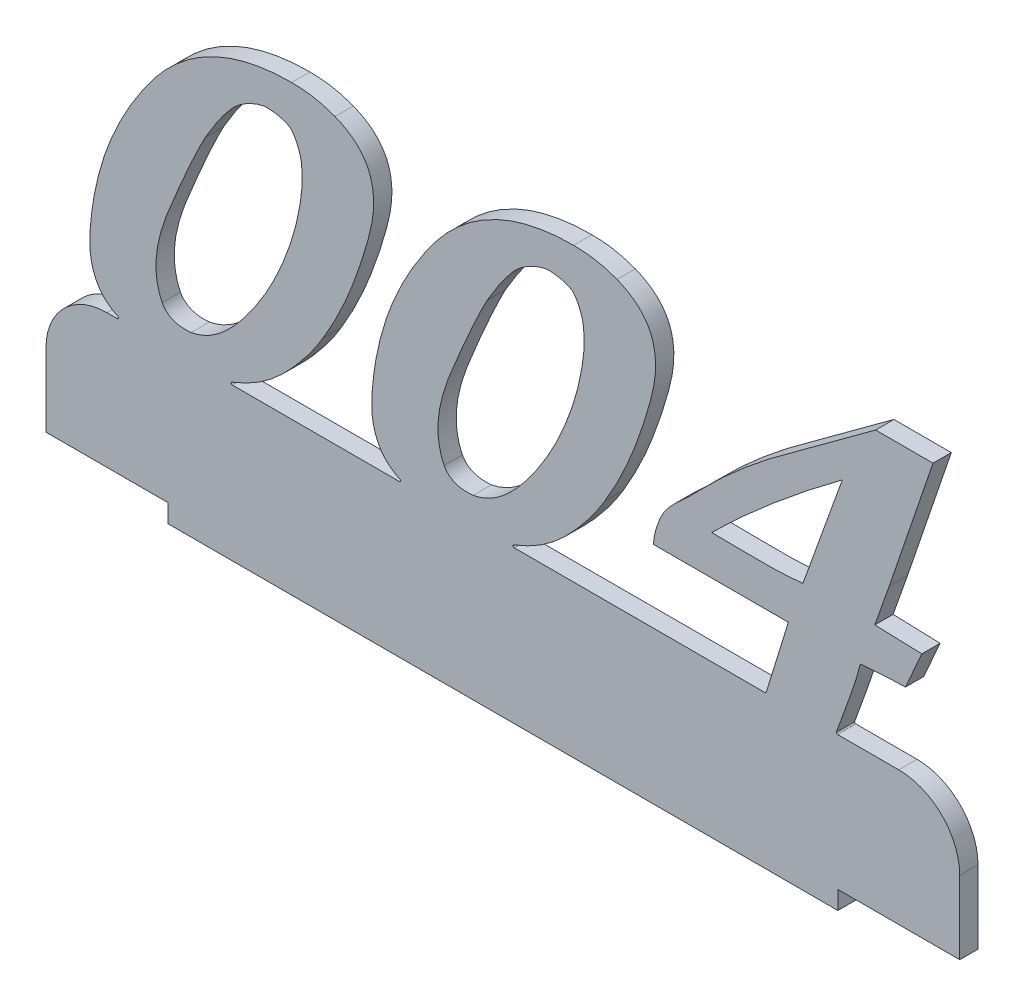
from build123d import *

# Parameters (mm, degrees)
BOSS_EXTRUDE1_DEPTH = 3
FILLET1_R           = 10
FILLET2_R           = 0.2


with BuildPart() as part:
    # Sketch1 → Boss-Extrude1 (new body)
    with BuildSketch(Plane.XY):
        with BuildLine():
            Line((129.670523122, 22.00000042), (150, 22.000001608))
            Line((150, 22.000001608), (150, 0))
            Line((150, 0), (130, 0))
            Line((130, 0), (130, -3))
            Line((130, -3), (20, -3))
            Line((20, -3), (20, 0))
            Line((20, 0), (0, 0))
            Line((0, 0), (0, 22.000000009))
            Line((0, 22.000000009), (12.808046382, 22.000000009))
            add(Edge.make_bspline(
                [(12.808046382, 22.000000009), (12.364004517, 22.144270634), (11.446828202, 22.485704618), (10.207076422, 23.292214922), (9.097113426, 24.311275464), (8.267240019, 25.588546311), (7.661757766, 27.060076512), (7.108133359, 29.424918694), (7.17776559, 31.344625269), (7.268107856, 32.659158535)],
                knots=[0.510217075, 0.510217075, 0.510217075, 0.510217075, 0.562299825, 0.61931963, 0.674487907, 0.729675441, 0.788153341, 0.851799168, 1, 1, 1, 1], degree=3))
            add(Edge.make_bspline(
                [(7.268107856, 32.659158535), (7.435031923, 34.887254942), (7.924224793, 38.212828568), (9.053611265, 42.549632686), (10.11644366, 45.758996068), (11.471067103, 48.892333585), (13.009065327, 51.99816281), (14.816801856, 55.041311751), (16.823886932, 58.008445774), (19.021425369, 60.79779447), (21.495680175, 63.216608271), (24.137944609, 65.304239959), (27.018164863, 66.951630752), (30.053664859, 68.299472442), (34.476072536, 69.521801178), (37.954791392, 69.906515458), (40.321274393, 69.875733984)],
                knots=[0, 0, 0, 0, 0.122246067, 0.183381441, 0.245050885, 0.307031795, 0.37001055, 0.434578783, 0.500534692, 0.565957523, 0.628479512, 0.689453544, 0.749684058, 0.80955899, 0.870724503, 1, 1, 1, 1], degree=3))
            add(Edge.make_bspline(
                [(40.321274393, 69.875733984), (41.581513848, 69.86528413), (44.02435313, 69.721768199), (46.364507053, 69.011912404), (47.455754455, 68.605210137)],
                knots=[0, 0, 0, 0, 0.519885394, 1, 1, 1, 1], degree=3))
            add(Edge.make_bspline(
                [(47.455754455, 68.605210137), (48.723301869, 68.089911925), (50.518354527, 67.096561954), (52.257667193, 65.113649934), (53.167189286, 63.440175814), (53.682471868, 61.535257), (53.847782842, 59.418211638), (53.654675405, 57.087443094), (52.905275139, 53.748035551), (51.626754793, 49.581607466), (49.325571182, 43.278027952), (47.128655, 38.851750561), (45.462009342, 36.099346181)],
                knots=[0, 0, 0, 0, 0.111905612, 0.162582178, 0.212592743, 0.265416324, 0.321765959, 0.384451445, 0.45478123, 0.599580751, 0.738515281, 1, 1, 1, 1], degree=3))
            add(Edge.make_bspline(
                [(45.462009342, 36.099346181), (44.370525223, 34.242133898), (42.50022779, 31.671659412), (39.750876411, 28.548676302), (37.582181514, 26.479408468), (35.199749836, 24.671746013), (32.52002604, 23.1759519), (30.552809414, 22.376261659), (29.502251655, 22.015031961), (29.458207776, 22.000000009)],
                knots=[0, 0, 0, 0, 0.257859597, 0.380113614, 0.498337489, 0.61657684, 0.737567111, 0.865047578, 0.870621389, 0.870621389, 0.870621389, 0.870621389], degree=3))
            Line((29.458207776, 22.000000009), (59.094207445, 22.000000009))
            add(Edge.make_bspline(
                [(59.094207445, 22.000000009), (58.65016558, 22.144270634), (57.732989265, 22.485704618), (56.493237485, 23.292214922), (55.383274489, 24.311275464), (54.553401082, 25.588546311), (53.947918829, 27.060076512), (53.394294422, 29.424918694), (53.463926653, 31.344625269), (53.55426892, 32.659158535)],
                knots=[0.510217075, 0.510217075, 0.510217075, 0.510217075, 0.562299825, 0.61931963, 0.674487907, 0.729675441, 0.788153341, 0.851799168, 1, 1, 1, 1], degree=3))
            add(Edge.make_bspline(
                [(53.55426892, 32.659158535), (53.721192986, 34.887254942), (54.210385856, 38.212828568), (55.339772329, 42.549632686), (56.402604724, 45.758996068), (57.757228167, 48.892333585), (59.295226391, 51.99816281), (61.10296292, 55.041311751), (63.110047996, 58.008445774), (65.307586432, 60.79779447), (67.781841238, 63.216608271), (70.424105672, 65.304239959), (73.304325926, 66.951630752), (76.339825922, 68.299472442), (80.762233599, 69.521801178), (84.240952455, 69.906515458), (86.607435456, 69.875733984)],
                knots=[0, 0, 0, 0, 0.122246067, 0.183381441, 0.245050885, 0.307031795, 0.37001055, 0.434578783, 0.500534692, 0.565957523, 0.628479512, 0.689453544, 0.749684058, 0.80955899, 0.870724503, 1, 1, 1, 1], degree=3))
            add(Edge.make_bspline(
                [(86.607435456, 69.875733984), (87.867674911, 69.86528413), (90.310514193, 69.721768199), (92.650668116, 69.011912404), (93.741915519, 68.605210137)],
                knots=[0, 0, 0, 0, 0.519885394, 1, 1, 1, 1], degree=3))
            add(Edge.make_bspline(
                [(93.741915519, 68.605210137), (95.009462932, 68.089911925), (96.80451559, 67.096561954), (98.543828257, 65.113649934), (99.453350349, 63.440175814), (99.968632931, 61.535257), (100.133943905, 59.418211638), (99.940836468, 57.087443094), (99.191436203, 53.748035551), (97.912915856, 49.581607466), (95.611732246, 43.278027952), (93.414816063, 38.851750561), (91.748170405, 36.099346181)],
                knots=[0, 0, 0, 0, 0.111905612, 0.162582178, 0.212592743, 0.265416324, 0.321765959, 0.384451445, 0.45478123, 0.599580751, 0.738515281, 1, 1, 1, 1], degree=3))
            add(Edge.make_bspline(
                [(91.748170405, 36.099346181), (90.656686287, 34.242133898), (88.786388854, 31.671659411), (86.037037474, 28.548676302), (83.868342577, 26.479408468), (81.4859109, 24.671746014), (78.806187103, 23.175951895), (76.838970479, 22.37626167), (75.78841272, 22.015031961), (75.744368842, 22.000000009)],
                knots=[0, 0, 0, 0, 0.257859597, 0.380113614, 0.498337489, 0.61657684, 0.737567111, 0.865047578, 0.870621389, 0.870621389, 0.870621389, 0.870621389], degree=3))
            Line((75.744368842, 22.000000009), (118.18873048, 22.000000009))
            Line((118.18873048, 22.000000009), (121.869358834, 33.910135861))
            Line((121.869358834, 33.910135861), (99.703604338, 33.910135861))
            add(Edge.make_bspline(
                [(99.703604338, 33.910135861), (99.830404476, 35.692322466), (100.505011688, 37.350323507)],
                knots=[0, 0, 0, 1, 1, 1], degree=2))
            add(Edge.make_bspline(
                [(100.505011688, 37.350323507), (100.756017911, 38.154522565), (101.349123709, 39.283889102), (102.396096661, 40.657618772), (104.471028634, 42.686663842), (106.336772952, 44.302449772), (107.698131312, 45.794420458)],
                knots=[0, 0, 0, 0, 0.224443411, 0.338858347, 0.460950835, 1, 1, 1, 1], degree=3))
            add(Edge.make_bspline(
                [(107.698131312, 45.794420458), (109.815493475, 47.981684536), (113.228349727, 51.146752902), (118.123926181, 55.148278532), (122.073857442, 58.082384853), (125.991912154, 60.903795911), (130.695531711, 64.336063982), (134.065155155, 66.810510275), (136.196958521, 68.40974493)],
                knots=[0, 0, 0, 0, 0.250612348, 0.382931529, 0.520503025, 0.655730691, 0.780544062, 1, 1, 1, 1], degree=3))
            Line((136.196958521, 68.40974493), (145.618381508, 68.40974493))
            Line((145.618381508, 68.40974493), (138.444808404, 47.377688636))
            Line((138.444808404, 47.377688636), (136.060132876, 40.634138988))
            Line((136.060132876, 40.634138988), (143.78100856, 40.380034219))
            Line((143.78100856, 40.380034219), (141.083588701, 34.301066275))
            add(Edge.make_bspline(
                [(141.083588701, 34.301066275), (140.046454963, 34.309912171), (137.581997151, 34.189218305), (135.119795253, 34.039381564), (133.695003869, 33.910135861)],
                knots=[0, 0, 0, 0, 0.420206299, 1, 1, 1, 1], degree=3))
            add(Edge.make_bspline(
                [(133.695003869, 33.910135861), (133.182623099, 31.823180293), (132.138242503, 28.781969691), (130.694070764, 24.846577051), (129.996021633, 22.923098764), (129.670523122, 22.00000042)],
                knots=[0, 0, 0, 0, 0.502209297, 0.752080888, 0.981126801, 0.981126801, 0.981126801, 0.981126801], degree=3))
        make_face()
        with BuildLine():
            add(Edge.make_bspline(
                [(40.184448748, 63.269009981), (39.583188781, 63.678527131), (38.117900475, 64.184671326), (36.580104435, 64.311966462), (35.766935065, 64.265882538)],
                knots=[0, 0, 0, 0, 0.469698931, 1, 1, 1, 1], degree=3))
            add(Edge.make_bspline(
                [(35.766935065, 64.265882538), (34.622233793, 64.025194036), (33.004194885, 63.34766573), (31.115807941, 61.970099982), (28.807901264, 59.392039706), (27.2742035, 56.940455659), (26.130500351, 54.961738675)],
                knots=[0, 0, 0, 0, 0.252589616, 0.375811021, 0.503770371, 1, 1, 1, 1], degree=3))
            add(Edge.make_bspline(
                [(26.130500351, 54.961738675), (25.674221535, 54.163682921), (25.076001721, 52.847117295), (24.18448856, 51.028054936), (23.471020898, 49.446506986), (22.706639374, 47.727278502), (21.906152071, 45.860549658), (21.049553272, 43.864341557), (20.177489255, 41.776019848), (19.384500763, 39.677843854), (18.752845055, 37.650490668), (18.312039515, 35.743396963), (18.06913803, 33.95035312), (18.021824202, 32.27106859), (18.223528373, 30.245369383), (18.643036379, 28.821712032), (19.074206371, 27.967993562)],
                knots=[0, 0, 0, 0, 0.095871325, 0.150956838, 0.211549603, 0.277044413, 0.347448488, 0.423659813, 0.503898773, 0.583776288, 0.6578152, 0.725493304, 0.78794858, 0.846481479, 0.900510454, 1, 1, 1, 1], degree=3))
            add(Edge.make_bspline(
                [(19.074206371, 27.967993562), (19.432653212, 27.224976544), (20.932127268, 26.017701062), (22.845028315, 26.001112811), (23.824010906, 26.071981052)],
                knots=[0, 0, 0, 0, 0.446153942, 1, 1, 1, 1], degree=3))
            add(Edge.make_bspline(
                [(23.824010906, 26.071981052), (25.281535404, 26.346336261), (27.438130672, 27.364756826), (29.970432189, 29.532526358), (31.920894139, 31.689718936), (33.787693178, 34.175238108), (35.549218944, 36.849239904), (37.139667082, 39.675726502), (38.534195001, 42.631974502), (39.732345169, 45.648958962), (40.723880148, 48.661020811), (41.442562037, 51.649517665), (41.947099245, 54.540121013), (42.116716065, 57.241876269), (41.914849931, 60.272439434), (41.040003319, 62.260990898), (40.184448748, 63.269009981)],
                knots=[0, 0, 0, 0, 0.099522769, 0.157975555, 0.224341199, 0.295661745, 0.367825167, 0.440561069, 0.514605516, 0.588508481, 0.659789613, 0.728660389, 0.796041852, 0.857776262, 0.9112652, 1, 1, 1, 1], degree=3))
        make_face(mode=Mode.SUBTRACT)
        with BuildLine():
            add(Edge.make_bspline(
                [(86.470609811, 63.269009981), (85.869349845, 63.678527131), (84.404061539, 64.184671326), (82.866265499, 64.311966462), (82.053096129, 64.265882538)],
                knots=[0, 0, 0, 0, 0.469698931, 1, 1, 1, 1], degree=3))
            add(Edge.make_bspline(
                [(82.053096129, 64.265882538), (80.908394857, 64.025194036), (79.290355949, 63.34766573), (77.401969005, 61.970099982), (75.094062327, 59.392039706), (73.560364564, 56.940455659), (72.416661414, 54.961738675)],
                knots=[0, 0, 0, 0, 0.252589616, 0.375811021, 0.503770371, 1, 1, 1, 1], degree=3))
            add(Edge.make_bspline(
                [(72.416661414, 54.961738675), (71.960382598, 54.163682921), (71.362162784, 52.847117295), (70.470649623, 51.028054936), (69.757181962, 49.446506986), (68.992800438, 47.727278502), (68.192313134, 45.860549658), (67.335714335, 43.864341557), (66.463650318, 41.776019848), (65.670661826, 39.677843854), (65.039006118, 37.650490668), (64.598200578, 35.743396963), (64.355299093, 33.95035312), (64.307985265, 32.27106859), (64.509689436, 30.245369383), (64.929197442, 28.821712032), (65.360367434, 27.967993562)],
                knots=[0, 0, 0, 0, 0.095871325, 0.150956838, 0.211549603, 0.277044413, 0.347448488, 0.423659813, 0.503898773, 0.583776288, 0.6578152, 0.725493304, 0.78794858, 0.846481479, 0.900510454, 1, 1, 1, 1], degree=3))
            add(Edge.make_bspline(
                [(65.360367434, 27.967993562), (65.718814276, 27.224976544), (67.218288332, 26.017701062), (69.131189378, 26.001112811), (70.110171969, 26.071981052)],
                knots=[0, 0, 0, 0, 0.446153942, 1, 1, 1, 1], degree=3))
            add(Edge.make_bspline(
                [(70.110171969, 26.071981052), (71.567696467, 26.346336261), (73.724291736, 27.364756826), (76.256593253, 29.532526358), (78.207055202, 31.689718936), (80.073854241, 34.175238108), (81.835380007, 36.849239904), (83.425828145, 39.675726502), (84.820356064, 42.631974502), (86.018506232, 45.648958962), (87.010041211, 48.661020811), (87.7287231, 51.649517665), (88.233260309, 54.540121013), (88.402877128, 57.241876269), (88.201010994, 60.272439434), (87.326164382, 62.260990898), (86.470609811, 63.269009981)],
                knots=[0, 0, 0, 0, 0.099522769, 0.157975555, 0.224341199, 0.295661745, 0.367825167, 0.440561069, 0.514605516, 0.588508481, 0.659789613, 0.728660389, 0.796041852, 0.857776262, 0.9112652, 1, 1, 1, 1], degree=3))
        make_face(mode=Mode.SUBTRACT)
        with BuildLine():
            add(Edge.make_bspline(
                [(130.72393272, 58.577845008), (126.767081716, 55.651096154), (119.396993576, 49.835462508), (112.455049817, 43.514898523), (109.281399491, 40.380034219)],
                knots=[0, 0, 0, 0, 0.524587428, 1, 1, 1, 1], degree=3))
            add(Edge.make_bspline(
                [(109.281399491, 40.380034219), (111.777750111, 40.416400562), (116.769366462, 40.215869848), (121.767741582, 40.35917562), (124.254034362, 40.634138988)],
                knots=[0, 0, 0, 0, 0.499665743, 1, 1, 1, 1], degree=3))
            add(Edge.make_bspline(
                [(124.254034362, 40.634138988), (125.359928867, 43.626758817), (127.448174311, 49.632469558), (129.630591187, 55.604582893), (130.72393272, 58.577845008)],
                knots=[0, 0, 0, 0, 0.501754487, 1, 1, 1, 1], degree=3))
        make_face(mode=Mode.SUBTRACT)
    extrude(amount=BOSS_EXTRUDE1_DEPTH)

    # Fillet1
    fillet1_edges = [part.edges().sort_by_distance(p)[0] for p in [
        (150, 22.000001608, 1.5),
        (0, 22.000000009, 1.5),
    ]]
    fillet(fillet1_edges, radius=FILLET1_R)

    # Fillet2
    fillet2_edges = [part.edges().sort_by_distance(p)[0] for p in [
        (59.094207445, 22.000000009, 1.5),
        (118.18873048, 22.000000009, 1.5),
        (12.808046382, 22.000000009, 1.5),
        (129.670523122, 22.00000042, 1.5),
        (75.744368842, 22.000000009, 1.5),
        (29.458207776, 22.000000009, 1.5),
    ]]
    fillet(fillet2_edges, radius=FILLET2_R)


solid = part.part
